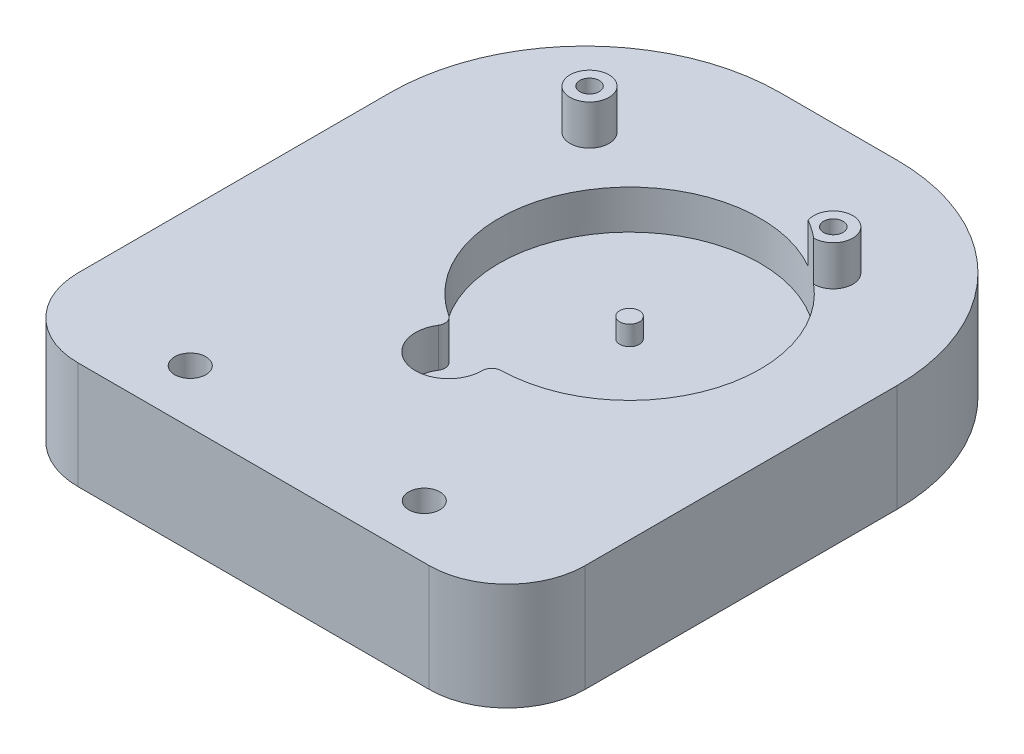
from build123d import *

# Parameters (mm, degrees)
SKETCH3_W           = 26
SKETCH3_H           = 30
BOSS_EXTRUDE1_DEPTH = 3
SKETCH4_R           = 4
SKETCH4_R_2         = 0.5
CUT_EXTRUDE1_DEPTH  = 21.0748599
SKETCH5_W           = 18.5
SKETCH5_H           = 19.853103052
BOSS_EXTRUDE2_DEPTH = 2.5
FILLET2_R           = 10
FILLET3_R           = 10
FILLET10_R          = 4
FILLET11_R          = 4
M2_TAPPED_HOLE1_D   = 1.6
SKETCH10_W          = 18.5
SKETCH10_H          = 19.853103052
BOSS_EXTRUDE3_DEPTH = 0.5
SKETCH14_R          = 0.5
CUT_EXTRUDE2_DEPTH  = 0.5
BOSS_EXTRUDE4_START = 2
SKETCH15_W          = 18.5
SKETCH15_H          = 19.853103052
SKETCH15_R          = 0.5
BOSS_EXTRUDE4_DEPTH = 2
BOSS_EXTRUDE5_START = 2.05
SKETCH16_R          = 1
SKETCH16_R_2        = 0.5
BOSS_EXTRUDE5_DEPTH = 2.05
BOSS_EXTRUDE6_START = -4.5
SKETCH17_R          = 0.5
BOSS_EXTRUDE6_DEPTH = 4.5
FILLET12_R          = 0.5
SKETCH19_R          = 4
BOSS_EXTRUDE7_DEPTH = 4
SKETCH21_W          = 10
SKETCH21_H          = 1
CUT_EXTRUDE5_DEPTH  = 11
SKETCH22_R          = 1
CUT_EXTRUDE6_DEPTH  = 24.838047483
SKETCH24_W          = 3.80106904
SKETCH24_H          = 1
CUT_EXTRUDE7_DEPTH  = 3


with BuildPart() as part:
    # Sketch3 → Boss-Extrude1 (new body)
    with BuildSketch(Plane(origin=(0, 0, 0), x_dir=(1, 0, 0), z_dir=(0, 1, 0))):
        Rectangle(SKETCH3_W, SKETCH3_H)
    extrude(amount=BOSS_EXTRUDE1_DEPTH)

    # Sketch4 → Cut-Extrude1 (cut, through all)
    with BuildSketch(Plane(origin=(0, 3, 0), x_dir=(1, 0, 0), z_dir=(0, 1, 0))):
        with Locations(Location((0, -5, 0), (0, 0, 270))):
            Circle(SKETCH4_R)
        with Locations(Location((2.067280169, 2.20946272, 0), (0, 0, 270))):
            Circle(SKETCH4_R_2)
        with Locations(Location((6.369103441, 8.353103052, 0), (0, 0, 270))):
            Circle(SKETCH4_R_2)
        with Locations(Location((-6.130896559, 8.353103052, 0), (0, 0, 270))):
            Circle(SKETCH4_R_2)
    extrude(amount=-CUT_EXTRUDE1_DEPTH, mode=Mode.SUBTRACT)

    # Sketch5 → Boss-Extrude2 (add)
    with BuildSketch(Plane(origin=(0, 3, 0), x_dir=(1, 0, 0), z_dir=(0, 1, 0))):
        Polygon((0, -15), (-13, -15), (-13, 15), (13, 15), (13, -15), align=None)
        with Locations((0.119103441, 0.426551526)):
            Rectangle(SKETCH5_W, SKETCH5_H, mode=Mode.SUBTRACT)
    extrude(amount=BOSS_EXTRUDE2_DEPTH)

    # Fillet2
    fillet2_edges = [part.edges().sort_by_distance(p)[0] for p in [
        (-13, 2.75, -15),
    ]]
    fillet(fillet2_edges, radius=FILLET2_R)

    # Fillet3
    fillet3_edges = [part.edges().sort_by_distance(p)[0] for p in [
        (13, 2.75, -15),
    ]]
    fillet(fillet3_edges, radius=FILLET3_R)

    # Fillet10
    fillet10_edges = [part.edges().sort_by_distance(p)[0] for p in [
        (-13, 2.75, 15),
    ]]
    fillet(fillet10_edges, radius=FILLET10_R)

    # Fillet11
    fillet11_edges = [part.edges().sort_by_distance(p)[0] for p in [
        (13, 2.75, 15),
    ]]
    fillet(fillet11_edges, radius=FILLET11_R)

    # M2 Tapped Hole1 (through all)
    with Locations(Plane(origin=(0, 5.5, 0), x_dir=(1, 0, 0), z_dir=(0, 1, 0))):
        with Locations((-6, -12.25), (6, -12.25)):
            Hole(M2_TAPPED_HOLE1_D / 2)

    # Sketch10 → Boss-Extrude3 (add)
    with BuildSketch(Plane(origin=(0, 3, 0), x_dir=(1, 0, 0), z_dir=(0, 1, 0))):
        with Locations((0.119103441, 0.426551526)):
            Rectangle(SKETCH10_W, SKETCH10_H)
    extrude(amount=BOSS_EXTRUDE3_DEPTH)

    # Sketch14 → Cut-Extrude2 (cut)
    with BuildSketch(Plane(origin=(0, 3.5, 0), x_dir=(1, 0, 0), z_dir=(0, 1, 0))):
        with Locations(Location((0, -5, 0), (0, 0, 270))):
            Circle(SKETCH14_R)
        with Locations(Location((2.067280169, 2.20946272, 0), (0, 0, 270))):
            Circle(SKETCH14_R)
        with Locations(Location((6.369103441, 8.353103052, 0), (0, 0, 270))):
            Circle(SKETCH14_R)
        with Locations(Location((-6.130896559, 8.353103052, 0), (0, 0, 270))):
            Circle(SKETCH14_R)
    extrude(amount=-CUT_EXTRUDE2_DEPTH, mode=Mode.SUBTRACT)

    # Sketch15 → Boss-Extrude4 (add)
    with BuildSketch(Plane(origin=(0, 3.5, 0), x_dir=(1, 0, 0), z_dir=(0, 1, 0)).offset(BOSS_EXTRUDE4_START)):
        with Locations((0.119103441, 0.426551526)):
            Rectangle(SKETCH15_W, SKETCH15_H)
        with Locations(Location((6.369103441, 8.353103052, 0), (0, 0, 270))):
            Circle(SKETCH15_R, mode=Mode.SUBTRACT)
        with Locations(Location((-6.130896559, 8.353103052, 0), (0, 0, 270))):
            Circle(SKETCH15_R, mode=Mode.SUBTRACT)
        with BuildLine():
            ThreePointArc((-1.093318964, -3.698211368), (-0.468583505, -6.634144883), (1.61702994, -4.47539141))
            ThreePointArc((1.61702994, -4.47539141), (3.914050453, 8.649916082), (-1.093318964, -3.698211368))
        make_face(mode=Mode.SUBTRACT)
    extrude(amount=-BOSS_EXTRUDE4_DEPTH)

    # Sketch16 → Boss-Extrude5 (add)
    # profile 1 of 2: a face of its own
    with BuildSketch(Plane(origin=(0, 5.5, 0), x_dir=(1, 0, 0), z_dir=(0, 1, 0)).offset(BOSS_EXTRUDE5_START)):
        with Locations(Location((-6.130896559, 8.353103052, 0), (0, 0, 270))):
            Circle(SKETCH16_R)
        with Locations(Location((-6.130896559, 8.353103052, 0), (0, 0, 270))):
            Circle(SKETCH16_R_2, mode=Mode.SUBTRACT)
    # profile 2 of 2: a face of its own
    with BuildSketch(Plane(origin=(0, 5.5, 0), x_dir=(1, 0, 0), z_dir=(0, 1, 0)).offset(BOSS_EXTRUDE5_START)):
        with BuildLine():
            ThreePointArc((6.36059965, 7.35313921), (6.942679878, 9.172255096), (5.432353266, 8.003104325))
            ThreePointArc((5.432353266, 8.003104325), (5.910242292, 7.697781416), (6.36059965, 7.35313921))
        make_face()
        with Locations(Location((6.369103441, 8.353103052, 0), (0, 0, 270))):
            Circle(SKETCH16_R_2, mode=Mode.SUBTRACT)
    extrude(amount=-BOSS_EXTRUDE5_DEPTH)

    # Sketch17 → Boss-Extrude6 (add)
    with BuildSketch(Plane.XZ.offset(BOSS_EXTRUDE6_START)):
        with Locations(Location((2.067280169, -2.20946272, 0), (0, 0, 270))):
            Circle(SKETCH17_R)
    extrude(amount=BOSS_EXTRUDE6_DEPTH)

    # Fillet12
    fillet12_edges = [part.edges().sort_by_distance(p)[0] for p in [
        (1.61702994, 4.5, 4.47539141),
        (-1.093318964, 4.5, 3.698211368),
    ]]
    fillet(fillet12_edges, radius=FILLET12_R)

    # Sketch19 → Boss-Extrude7 (add)
    with BuildSketch(Plane.XZ):
        with BuildLine():
            Line((-4.769696007, 6.5), (-7.769696007, 6.5))
            Line((-7.769696007, 6.5), (-7.769696007, 3.5))
            Line((-7.769696007, 3.5), (-4.769696007, 3.5))
            ThreePointArc((-4.769696007, 3.5), (5, 5), (-4.769696007, 6.5))
        make_face()
        with Locations(Location((0, 5, 0), (0, 0, 90))):
            Circle(SKETCH19_R, mode=Mode.SUBTRACT)
    extrude(amount=BOSS_EXTRUDE7_DEPTH)

    # Sketch21 → Cut-Extrude5 (cut)
    with BuildSketch(Plane.ZY.offset(7.769696007)):
        with Locations((5, -0.5)):
            Rectangle(SKETCH21_W, SKETCH21_H)
    extrude(amount=-CUT_EXTRUDE5_DEPTH, mode=Mode.SUBTRACT)

    # Sketch22 → Cut-Extrude6 (cut, through all)
    with BuildSketch(Plane(origin=(0, 0, 3.5), x_dir=(-1, 0, 0), z_dir=(0, 0, -1))):
        with Locations((6.519696007, -2.5)):
            Circle(SKETCH22_R)
    extrude(amount=-CUT_EXTRUDE6_DEPTH, mode=Mode.SUBTRACT)

    # Sketch24 → Cut-Extrude7 (cut)
    with BuildSketch(Plane.XZ.offset(4)):
        with Locations((-5.869161487, 5)):
            Rectangle(SKETCH24_W, SKETCH24_H)
    extrude(amount=-CUT_EXTRUDE7_DEPTH, mode=Mode.SUBTRACT)


solid = part.part
